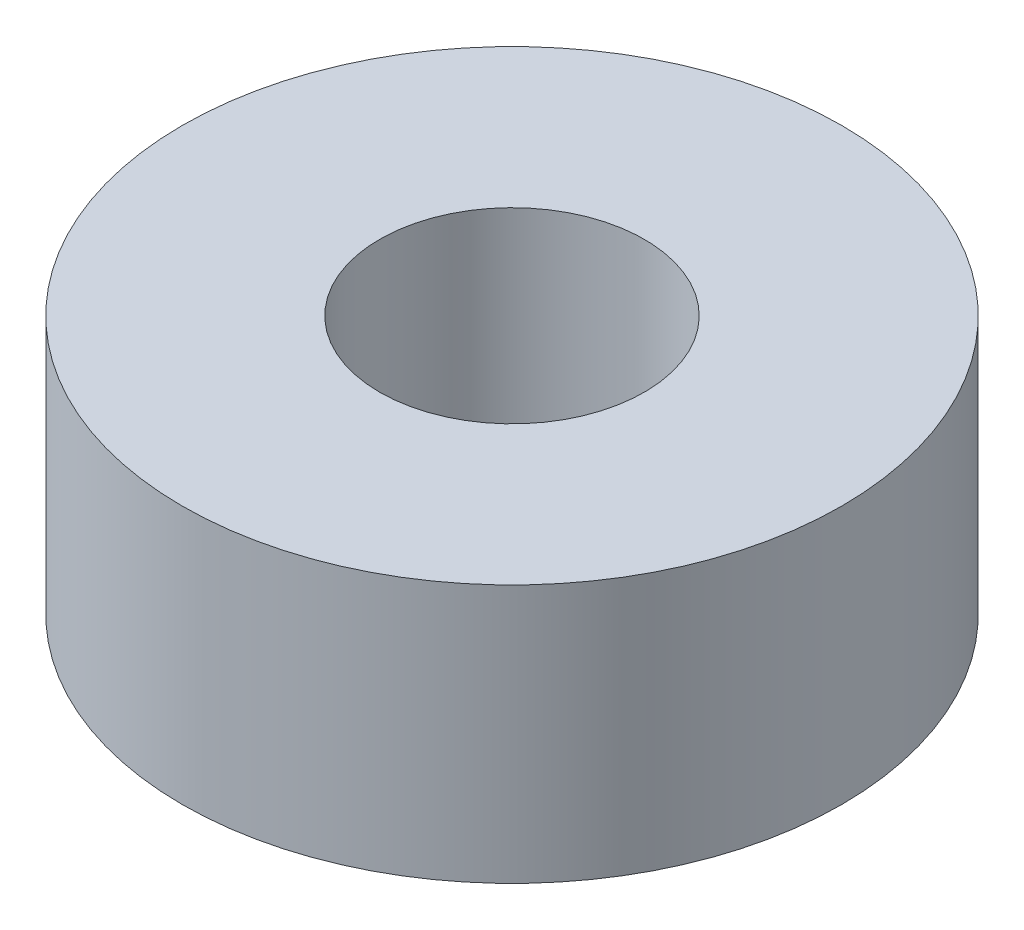
from build123d import *

# Parameters (mm, degrees)
SKETCH1_R           = 6.35
SKETCH1_R_2         = 2.55
BOSS_EXTRUDE1_DEPTH = 4.9784


with BuildPart() as part:
    # Sketch1 → Boss-Extrude1 (new body)
    with BuildSketch(Plane(origin=(0, 0, 0), x_dir=(1, 0, 0), z_dir=(0, 1, 0))):
        with Locations(Location((0, 0, 0), (0, 0, 270))):
            Circle(SKETCH1_R)
        with Locations(Location((0, 0, 0), (0, 0, 270))):
            Circle(SKETCH1_R_2, mode=Mode.SUBTRACT)
    extrude(amount=BOSS_EXTRUDE1_DEPTH)


solid = part.part
